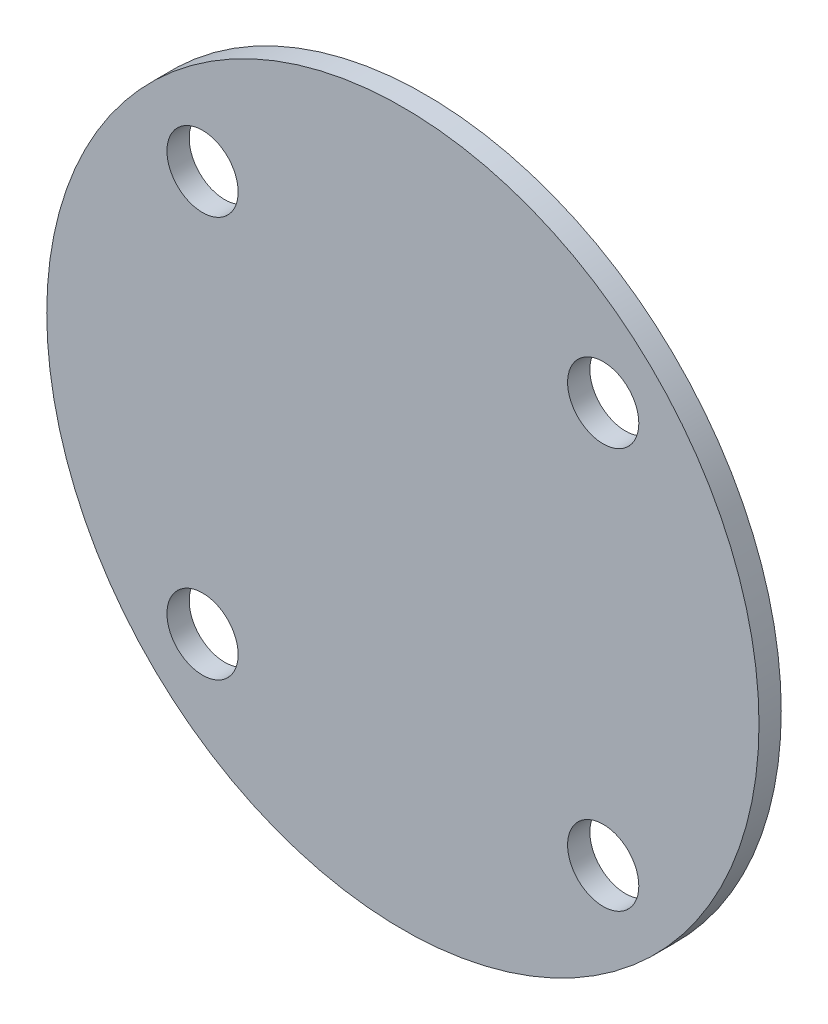
from build123d import *

# Parameters (mm, degrees)
SKETCH1_R           = 16
BOSS_EXTRUDE1_DEPTH = 1
SKETCH12_R          = 1.6
CUT_EXTRUDE4_DEPTH  = 23.649503306


with BuildPart() as part:
    # Sketch1 → Boss-Extrude1 (new body)
    with BuildSketch(Plane.XY):
        Circle(SKETCH1_R)
    extrude(amount=BOSS_EXTRUDE1_DEPTH)

    # Sketch12 → Cut-Extrude4 (cut, through all)
    with BuildSketch(Plane.XY):
        with Locations((9, 9)):
            Circle(SKETCH12_R)
        with Locations((9, -9)):
            Circle(SKETCH12_R)
        with Locations((-9, -9)):
            Circle(SKETCH12_R)
        with Locations((-9, 9)):
            Circle(SKETCH12_R)
    extrude(amount=CUT_EXTRUDE4_DEPTH, mode=Mode.SUBTRACT)


solid = part.part
